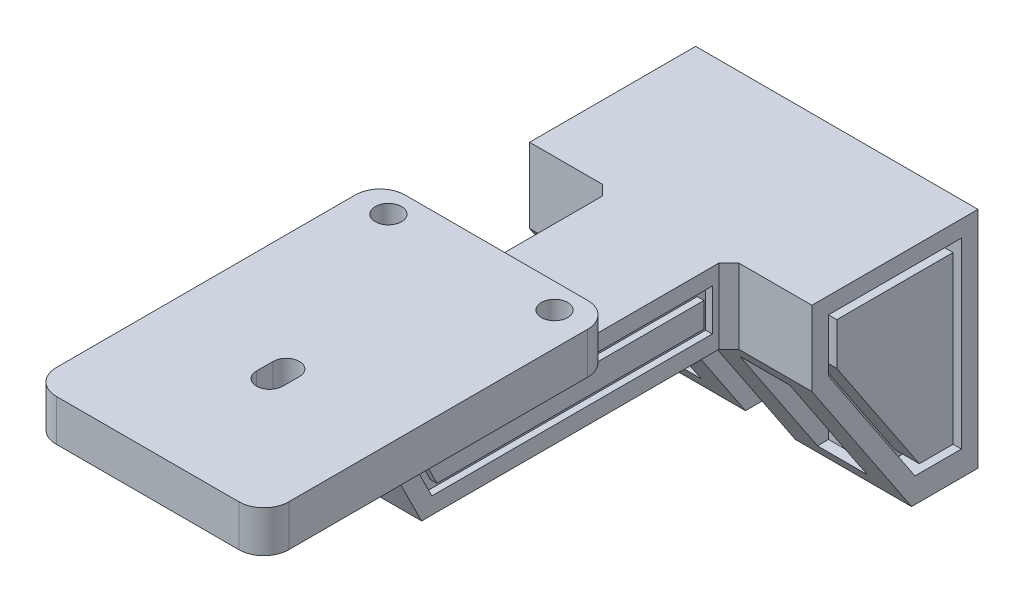
from build123d import *

# Parameters (mm, degrees)
SKETCH1_W                = 28
SKETCH1_H                = 42
BOSS_EXTRUDE1_DEPTH      = 5
FILLET1_R                = 3
SKETCH3_R                = 1.585
CUT_EXTRUDE1_DEPTH       = 5
SKETCH4_W                = 14
SKETCH4_H                = 63
BOSS_EXTRUDE2_DEPTH      = 12
SKETCH5_W                = 14
SKETCH5_H                = 41
CUT_EXTRUDE2_DEPTH       = 3
SKETCH6_W                = 4
SKETCH6_H                = 8
BOSS_EXTRUDE3_DEPTH      = 18
SKETCH7_W                = 8
SKETCH7_H                = 27
BOSS_EXTRUDE4_DEPTH      = 10
SKETCH8_W                = 8
SKETCH8_H                = 27
BOSS_EXTRUDE5_DEPTH      = 10
BOSS_EXTRUDE6_DEPTH      = 10
BOSS_EXTRUDE6_DEPTH_BACK = 4
BOSS_EXTRUDE7_DEPTH      = 10
BOSS_EXTRUDE7_DEPTH_BACK = 4
CUT_EXTRUDE5_DEPTH       = 16
BOSS_EXTRUDE8_DEPTH      = 14
SKETCH16_R               = 2
CUT_EXTRUDE6_DEPTH       = 27
CUT_EXTRUDE8_START       = -8
SKETCH19_W               = 6
SKETCH19_H               = 14
CUT_EXTRUDE8_DEPTH       = 14
CUT_EXTRUDE9_DEPTH       = 1
CUT_EXTRUDE10_START      = -31
CUT_EXTRUDE10_DEPTH      = 3
CUT_EXTRUDE11_DEPTH      = 0.8
CUT_EXTRUDE12_START      = -13.2
CUT_EXTRUDE12_DEPTH      = 7.8
BOSS_EXTRUDE10_DEPTH     = 9


with BuildPart() as part:
    # Sketch1 → Boss-Extrude1 (new body)
    with BuildSketch(Plane(origin=(0, 0, 0), x_dir=(1, 0, 0), z_dir=(0, 1, 0))):
        Rectangle(SKETCH1_W, SKETCH1_H)
    extrude(amount=BOSS_EXTRUDE1_DEPTH)

    # Fillet1
    fillet1_edges = [part.edges().sort_by_distance(p)[0] for p in [
        (-14, 2.5, 21),
        (-14, 2.5, -21),
        (14, 2.5, -21),
        (14, 2.5, 21),
    ]]
    fillet(fillet1_edges, radius=FILLET1_R)

    # Sketch3 → Cut-Extrude1 (cut)
    with BuildSketch(Plane(origin=(0, 5, 0), x_dir=(1, 0, 0), z_dir=(0, 1, 0))):
        with Locations(Location((10, 18, 0), (0, 0, 270))):
            Circle(SKETCH3_R)
        with Locations(Location((-10, 18, 0), (0, 0, 270))):
            Circle(SKETCH3_R)
        with BuildLine():
            Line((1.585, -4.3), (1.585, -6.3))
            ThreePointArc((1.585, -6.3), (0, -7.885), (-1.585, -6.3))
            Line((-1.585, -6.3), (-1.585, -4.3))
            ThreePointArc((-1.585, -4.3), (0, -2.715), (1.585, -4.3))
        make_face()
    extrude(amount=-CUT_EXTRUDE1_DEPTH, mode=Mode.SUBTRACT)

    # Sketch4 → Boss-Extrude2 (add)
    with BuildSketch(Plane.XZ):
        with Locations((0, -30.5)):
            Rectangle(SKETCH4_W, SKETCH4_H)
    extrude(amount=BOSS_EXTRUDE2_DEPTH)

    # Sketch5 → Cut-Extrude2 (cut)
    with BuildSketch(Plane(origin=(0, 0, 0), x_dir=(1, 0, 0), z_dir=(0, 1, 0))):
        with Locations((0, 41.5)):
            Rectangle(SKETCH5_W, SKETCH5_H)
    extrude(amount=-CUT_EXTRUDE2_DEPTH, mode=Mode.SUBTRACT)

    # Sketch6 → Boss-Extrude3 (add)
    with BuildSketch(Plane.XZ.offset(12)):
        with Locations((-5, -58)):
            Rectangle(SKETCH6_W, SKETCH6_H)
        with Locations((5, -58)):
            Rectangle(SKETCH6_W, SKETCH6_H)
    extrude(amount=BOSS_EXTRUDE3_DEPTH)

    # Sketch7 → Boss-Extrude4 (add)
    with BuildSketch(Plane.ZY.offset(7)):
        with Locations((-58, -16.5)):
            Rectangle(SKETCH7_W, SKETCH7_H)
    extrude(amount=BOSS_EXTRUDE4_DEPTH)

    # Sketch8 → Boss-Extrude5 (add)
    with BuildSketch(Plane(origin=(7, 0, 0), x_dir=(0, 0, -1), z_dir=(1, 0, 0))):
        with Locations((58, -16.5)):
            Rectangle(SKETCH8_W, SKETCH8_H)
    extrude(amount=BOSS_EXTRUDE5_DEPTH)

    # Sketch9 → Boss-Extrude6 (add, two sides: drawn at the far end of the back side and taken through both)
    with BuildSketch(Plane.ZY.offset(7).offset(-BOSS_EXTRUDE6_DEPTH_BACK)):
        Polygon((-54, -30), (-42, -12), (-42, -3), (-54, -3), align=None)
    extrude(amount=BOSS_EXTRUDE6_DEPTH + BOSS_EXTRUDE6_DEPTH_BACK)

    # Sketch10 → Boss-Extrude7 (add, two sides: drawn at the far end of the back side and taken through both)
    with BuildSketch(Plane(origin=(7, 0, 0), x_dir=(0, 0, -1), z_dir=(1, 0, 0)).offset(-BOSS_EXTRUDE7_DEPTH_BACK)):
        Polygon((42, -12), (42, -3), (54, -3), (54, -30), align=None)
    extrude(amount=BOSS_EXTRUDE7_DEPTH + BOSS_EXTRUDE7_DEPTH_BACK)

    # Sketch13 → Cut-Extrude5 (cut)
    with BuildSketch(Plane.ZY.offset(7)):
        Polygon((1, 0), (-5, -12), (1, -12), align=None)
    extrude(amount=-CUT_EXTRUDE5_DEPTH, mode=Mode.SUBTRACT)

    # Sketch14 → Boss-Extrude8 (add)
    with BuildSketch(Plane.ZY.offset(7)):
        Polygon((-21, 0), (-22.5, -3), (-21, -3), align=None)
    extrude(amount=-BOSS_EXTRUDE8_DEPTH)

    # Sketch16 → Cut-Extrude6 (cut)
    with BuildSketch(Plane(origin=(0, 0, -62), x_dir=(-1, 0, 0), z_dir=(0, 0, -1))):
        with Locations((-10, -17)):
            Circle(SKETCH16_R)
        with Locations((-10, -25)):
            Circle(SKETCH16_R)
        with Locations((10, -17)):
            Circle(SKETCH16_R)
        with Locations((10, -25)):
            Circle(SKETCH16_R)
    extrude(amount=-CUT_EXTRUDE6_DEPTH, mode=Mode.SUBTRACT)

    # Sketch19 → Cut-Extrude8 (cut)
    with BuildSketch(Plane(origin=(0, 0, -62), x_dir=(-1, 0, 0), z_dir=(0, 0, -1)).offset(CUT_EXTRUDE8_START)):
        with Locations((-10, -21)):
            Rectangle(SKETCH19_W, SKETCH19_H)
        with Locations((10, -21)):
            Rectangle(SKETCH19_W, SKETCH19_H)
    extrude(amount=-CUT_EXTRUDE8_DEPTH, mode=Mode.SUBTRACT)

    # Sketch20 → Cut-Extrude9 (cut)
    with BuildSketch(Plane.ZY.offset(17)):
        Polygon((-60, -5), (-60, -27), (-54.40370085, -27), (-44, -11.394448725), (-44, -5), align=None)
        Polygon((-59, -6), (-59, -26), (-54.938884609, -26), (-45, -11.091673087), (-45, -6), align=None, mode=Mode.SUBTRACT)
    extrude(amount=-CUT_EXTRUDE9_DEPTH, mode=Mode.SUBTRACT)

    # Sketch24 → Cut-Extrude10 (cut)
    with BuildSketch(Plane.ZY.offset(17).offset(CUT_EXTRUDE10_START)):
        Polygon((-60, -5), (-60, -27), (-54.40370085, -27), (-44, -11.394448725), (-44, -5), align=None)
        Polygon((-59, -6), (-59, -26), (-54.938884609, -26), (-45, -11.091673087), (-45, -6), align=None, mode=Mode.SUBTRACT)
    extrude(amount=-CUT_EXTRUDE10_DEPTH, mode=Mode.SUBTRACT)

    # Sketch25 → Cut-Extrude11 (cut)
    with BuildSketch(Plane.ZY.offset(7)):
        Polygon((-40, -5), (-21.263932023, -5), (-19.763932023, -2), (-2.236067977, -2), (-6.236067977, -10), (-40, -10), align=None)
        Polygon((-39, -6), (-20.645898034, -6), (-19.145898034, -3), (-3.854101966, -3), (-6.854101966, -9), (-39, -9), align=None, mode=Mode.SUBTRACT)
    extrude(amount=-CUT_EXTRUDE11_DEPTH, mode=Mode.SUBTRACT)

    # Sketch26 → Cut-Extrude12 (cut)
    with BuildSketch(Plane.ZY.offset(7).offset(CUT_EXTRUDE12_START)):
        Polygon((-40, -5), (-21.263932023, -5), (-19.763932023, -2), (-2.236067977, -2), (-6.236067977, -10), (-40, -10), align=None)
        Polygon((-39, -6), (-20.645898034, -6), (-19.145898034, -3), (-3.854101966, -3), (-6.854101966, -9), (-39, -9), align=None, mode=Mode.SUBTRACT)
    extrude(amount=-CUT_EXTRUDE12_DEPTH, mode=Mode.SUBTRACT)

    # Sketch30 → Boss-Extrude10 (add)
    with BuildSketch(Plane.XZ.offset(12)):
        Polygon((-7, -42), (-7, -40.8), (-8.2, -42), align=None)
        Polygon((7, -42), (7, -40.8), (8.2, -42), align=None)
    extrude(amount=-BOSS_EXTRUDE10_DEPTH)


solid = part.part
